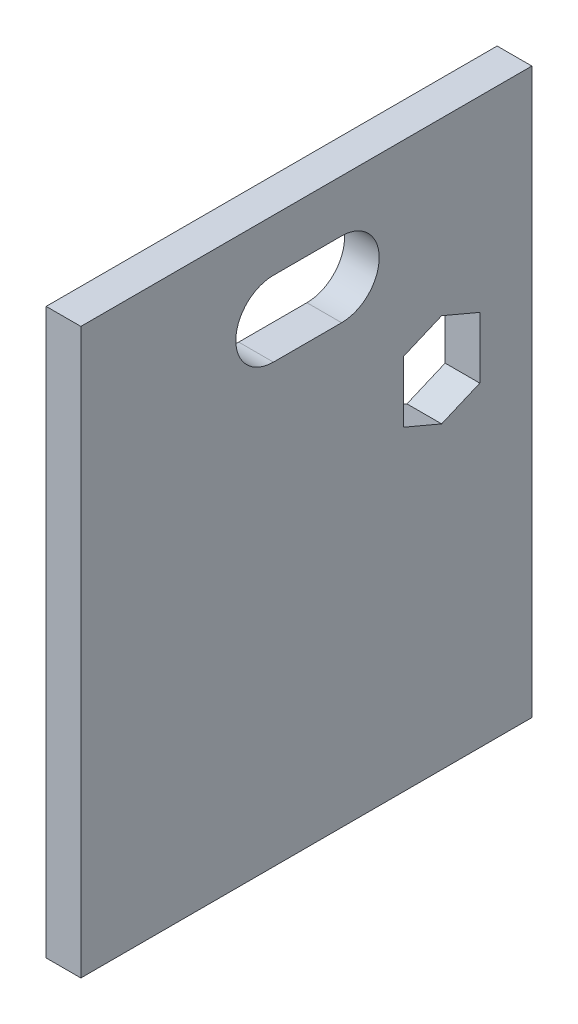
from build123d import *

# Parameters (mm, degrees)
CROQUIS1_W              = 244
CROQUIS1_H              = 195
SALIENTE_EXTRUIR1_DEPTH = 15


with BuildPart() as part:
    # Croquis1 → Saliente-Extruir1 (new body)
    with BuildSketch(Plane.YZ):
        with Locations((122, 97.5)):
            Rectangle(CROQUIS1_W, CROQUIS1_H)
        Polygon((163, 22.5), (136.5, 22.5), (129.831375645, 38.218900266), (129.5, 39), (129.831375684, 39.781099827), (136.5, 55.5), (163, 55.5), (169.668624522, 39.78109934), (170, 39), (169.668624483, 38.218900567), align=None, mode=Mode.SUBTRACT)
        with BuildLine():
            Line((189, 82.25), (189, 111.75))
            ThreePointArc((189, 111.75), (205.25, 128), (221.5, 111.75))
            Line((221.5, 111.75), (221.5, 82.25))
            ThreePointArc((221.5, 82.25), (205.25, 66), (189, 82.25))
        make_face(mode=Mode.SUBTRACT)
    extrude(amount=SALIENTE_EXTRUIR1_DEPTH)


solid = part.part
